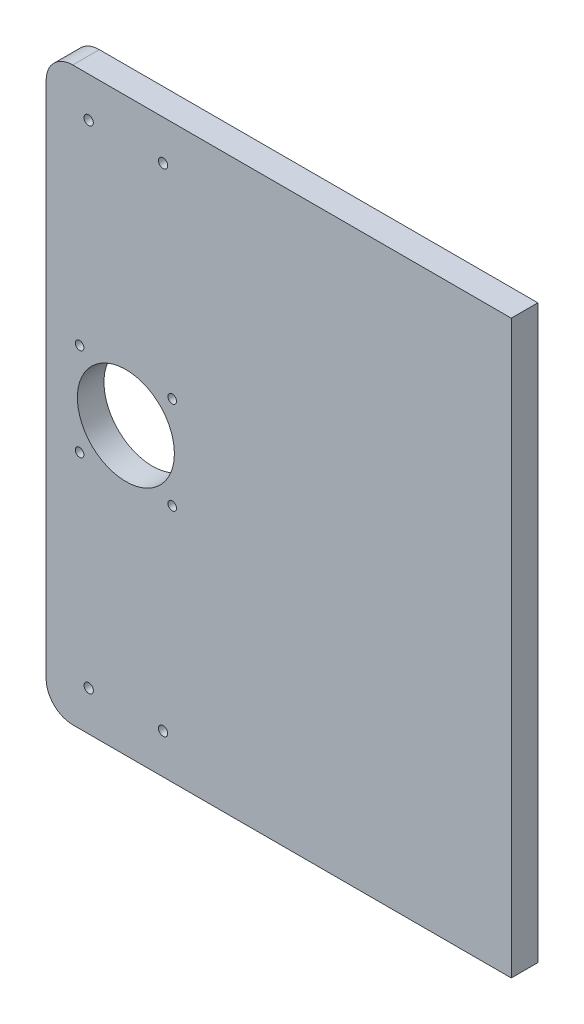
from build123d import *

# Parameters (mm, degrees)
SKETCH_1_W      = 350
SKETCH_1_H      = 430
SKETCH_1_R      = 3.5
SKETCH_1_R_2    = 3.25
SKETCH_1_R_3    = 36.5
EXTRUDE_1_DEPTH = 20
FILLET_2_R      = 20


with BuildPart() as part:
    # Эскиз1 → Бобышка-Вытянуть1 (new body)
    with BuildSketch(Plane.XY):
        with Locations((115, 0)):
            Rectangle(SKETCH_1_W, SKETCH_1_H)
        with Locations((-28, -185)):
            Circle(SKETCH_1_R, mode=Mode.SUBTRACT)
        with Locations((28, -185)):
            Circle(SKETCH_1_R, mode=Mode.SUBTRACT)
        with Locations((-34.85, -34.85)):
            Circle(SKETCH_1_R_2, mode=Mode.SUBTRACT)
        with Locations((34.85, -34.85)):
            Circle(SKETCH_1_R_2, mode=Mode.SUBTRACT)
        with Locations((-34.85, 34.85)):
            Circle(SKETCH_1_R_2, mode=Mode.SUBTRACT)
        Circle(SKETCH_1_R_3, mode=Mode.SUBTRACT)
        with Locations((34.85, 34.85)):
            Circle(SKETCH_1_R_2, mode=Mode.SUBTRACT)
        with Locations((-28, 185)):
            Circle(SKETCH_1_R, mode=Mode.SUBTRACT)
        with Locations((28, 185)):
            Circle(SKETCH_1_R, mode=Mode.SUBTRACT)
    extrude(amount=EXTRUDE_1_DEPTH)

    # Скругление2
    fillet_2_edges = [part.edges().sort_by_distance(p)[0] for p in [
        (-60, -215, 10),
        (-60, 215, 10),
    ]]
    fillet(fillet_2_edges, radius=FILLET_2_R)


solid = part.part
